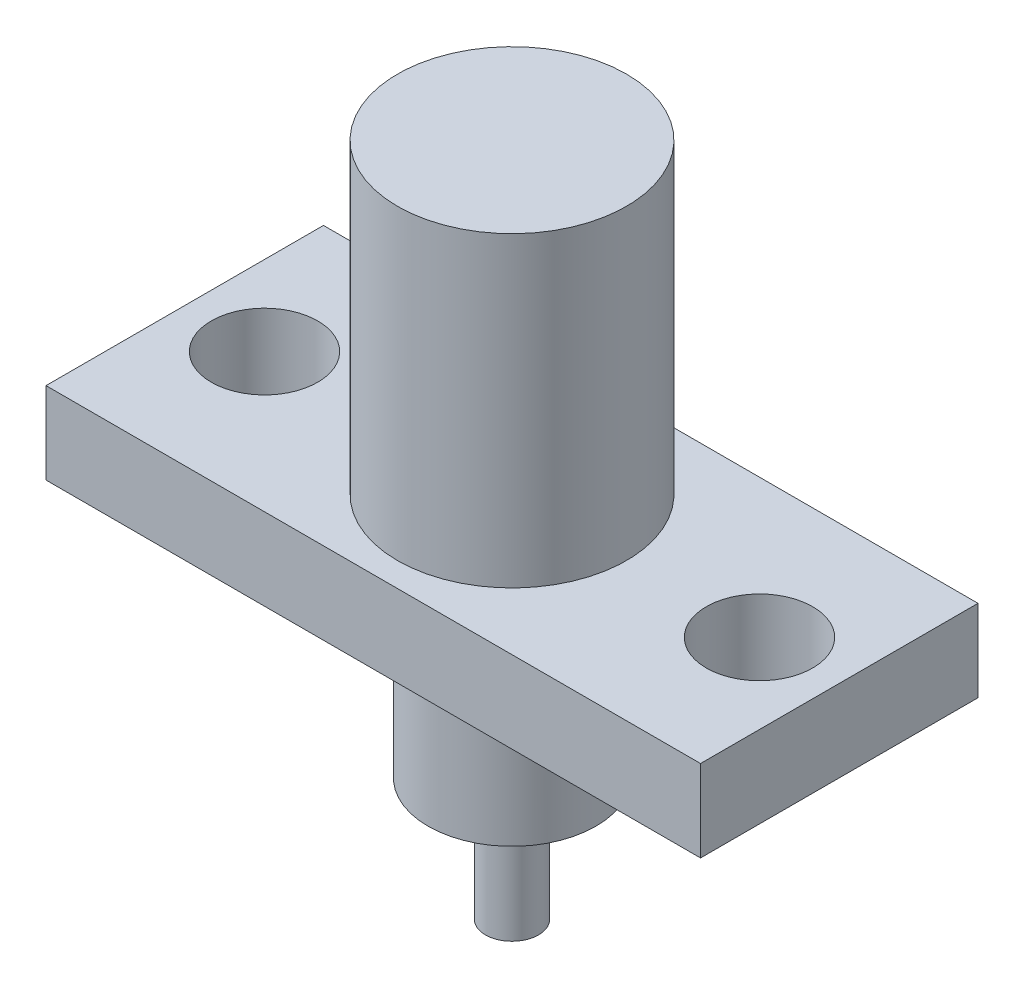
from build123d import *

# Parameters (mm, degrees)
SKETCH_1_W      = 16
SKETCH_1_H      = 6.782608696
SKETCH_1_R      = 1.3
EXTRUDE_1_DEPTH = 2
SKETCH_2_R      = 2.8
EXTRUDE_2_DEPTH = 7.5
SKETCH_3_R      = 2.05
EXTRUDE_3_DEPTH = 4
SKETCH_4_R      = 0.65
EXTRUDE_4_DEPTH = 3


with BuildPart() as part:
    # 草图1 → 凸台-拉伸1 (new body)
    with BuildSketch(Plane(origin=(0, 0, 0), x_dir=(1, 0, 0), z_dir=(0, 1, 0))):
        Rectangle(SKETCH_1_W, SKETCH_1_H)
        with Locations(Location((-6.05, 0, 0), (0, 0, 270))):
            Circle(SKETCH_1_R, mode=Mode.SUBTRACT)
        with Locations(Location((6.05, 0, 0), (0, 0, 270))):
            Circle(SKETCH_1_R, mode=Mode.SUBTRACT)
    extrude(amount=EXTRUDE_1_DEPTH)

    # 草图2 → 凸台-拉伸2 (add)
    with BuildSketch(Plane(origin=(0, 2, 0), x_dir=(1, 0, 0), z_dir=(0, 1, 0))):
        with Locations(Location((0, 0, 0), (0, 0, 270))):
            Circle(SKETCH_2_R)
    extrude(amount=EXTRUDE_2_DEPTH)

    # 草图3 → 凸台-拉伸3 (add)
    with BuildSketch(Plane.XZ):
        with Locations(Location((0, 0, 0), (0, 0, 90))):
            Circle(SKETCH_3_R)
    extrude(amount=EXTRUDE_3_DEPTH)

    # 草图4 → 凸台-拉伸4 (add)
    with BuildSketch(Plane.XZ.offset(4)):
        with Locations(Location((0, 0, 0), (0, 0, 270))):
            Circle(SKETCH_4_R)
    extrude(amount=EXTRUDE_4_DEPTH)


solid = part.part
